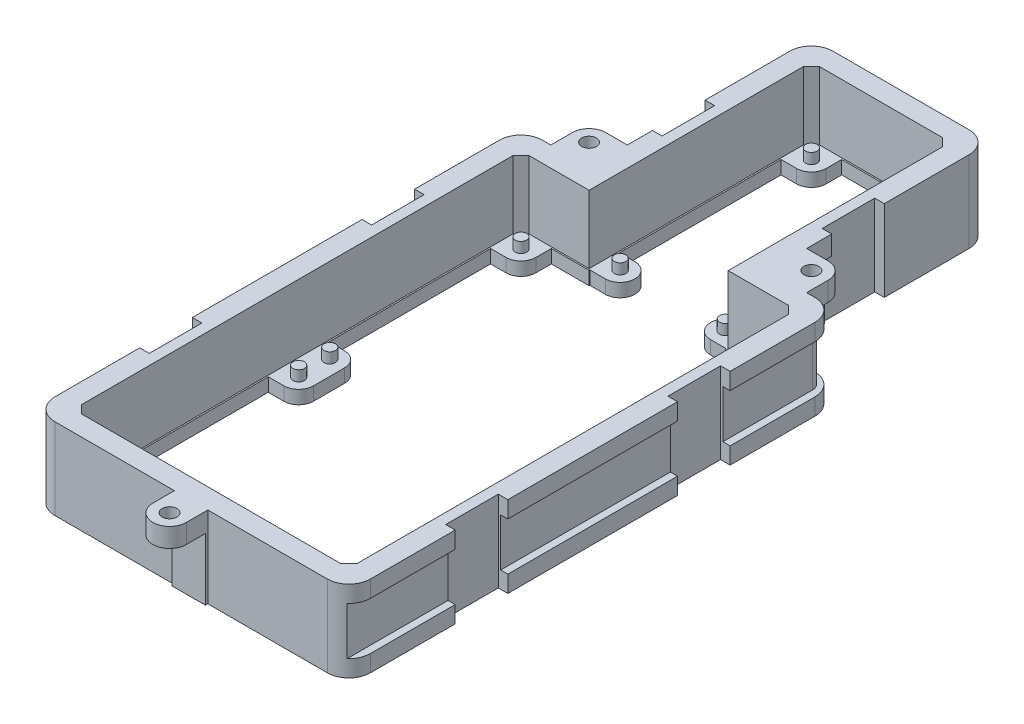
from build123d import *

# Parameters (mm, degrees)
EXTRUDE_THIN1_DEPTH          = 17
CHAMFER1_SIZE                = 1.5
SKETCH2_R                    = 1.2
BOSS_EXTRUDE1_DEPTH          = 5
BOSS_EXTRUDE1_2_DEPTH        = 5
BOSS_EXTRUDE1_3_DEPTH        = 5
BOSS_EXTRUDE1_4_DEPTH        = 5
BOSS_EXTRUDE1_5_DEPTH        = 5
BOSS_EXTRUDE1_6_DEPTH        = 5
BOSS_EXTRUDE1_7_DEPTH        = 5
BOSS_EXTRUDE1_8_DEPTH        = 5
BOSS_EXTRUDE1_9_DEPTH        = 5
BOSS_EXTRUDE1_10_DEPTH       = 5
BOSS_EXTRUDE1_11_DEPTH       = 5
BOSS_EXTRUDE1_12_DEPTH       = 5
BOSS_EXTRUDE1_13_DEPTH       = 5
BOSS_EXTRUDE1_14_DEPTH       = 5
BOSS_EXTRUDE3_DEPTH          = 2.8
SKETCH4_R                    = 1.55
BOSS_EXTRUDE4_DEPTH          = 4
SKETCH5_R                    = 1.55
BOSS_EXTRUDE5_DEPTH          = 4
FILLET1_R                    = 5
SKETCH6_W                    = 4
SKETCH6_H                    = 10
CUT_EXTRUDE1_DEPTH           = 105.953561159
CUT_EXTRUDE_THIN1_DEPTH      = 120.924976548
CUT_EXTRUDE_THIN1_DEPTH_BACK = 2
SKETCH7_W                    = 103
SKETCH7_H                    = 10
CUT_EXTRUDE_THIN2_DEPTH      = 120.924976548
CUT_EXTRUDE_THIN2_DEPTH_BACK = 2
SKETCH8_W                    = 103
SKETCH8_H                    = 10
SKETCH9_W                    = 13.25
SKETCH9_H                    = 13
CUT_EXTRUDE2_DEPTH           = 2
CUT_EXTRUDE3_DEPTH           = 14.25
FILLET2_R                    = 2
SKETCH11_W                   = 13.25
SKETCH11_H                   = 13
CUT_EXTRUDE4_DEPTH           = 2
SKETCH12_W                   = 2
SKETCH12_H                   = 9.5
CUT_EXTRUDE5_DEPTH           = 14.25
FILLET3_R                    = 2
CUT_EXTRUDE_THIN4_START      = -20
CUT_EXTRUDE_THIN4_DEPTH      = 20
CUT_EXTRUDE_THIN5_DEPTH      = 10
CUT_EXTRUDE_THIN6_DEPTH      = 14.2


with BuildPart() as part:
    # Sketch1 → Extrude-Thin1 (new body)
    with BuildSketch(Plane(origin=(0, 0, 0), x_dir=(1, 0, 0), z_dir=(0, 1, 0))):
        Polygon((19.25, 51.5), (33.5, 51.5), (33.5, -51.5), (-33.5, -51.5), (-33.5, 51.5), (-19.25, 51.5), (-19.25, 98), (19.25, 98), align=None)
        Polygon((14.25, 46.5), (28.5, 46.5), (28.5, -46.5), (-28.5, -46.5), (-28.5, 46.5), (-14.25, 46.5), (-14.25, 93), (14.25, 93), align=None, mode=Mode.SUBTRACT)
    extrude(amount=EXTRUDE_THIN1_DEPTH)

    # Chamfer1
    chamfer1_edges = [part.edges().sort_by_distance(p)[0] for p in [
        (28.5, 8.5, 46.5),
        (28.5, 8.5, -46.5),
        (14.25, 8.5, -93),
        (-14.25, 8.5, -93),
        (-28.5, 8.5, -46.5),
        (-28.5, 8.5, 46.5),
    ]]
    chamfer(chamfer1_edges, length=CHAMFER1_SIZE)



with BuildPart() as body_2:
    # Sketch2 → Boss-Extrude1 (new body)
    with BuildSketch(Plane(origin=(0, 0, 0), x_dir=(1, 0, 0), z_dir=(0, 1, 0))):
        with Locations(Location((11, 89.75, 0), (0, 0, 270))):
            Circle(SKETCH2_R)
    extrude(amount=BOSS_EXTRUDE1_DEPTH)


with BuildPart() as body_3:
    # Sketch2 → Boss-Extrude1 2 (new body)
    with BuildSketch(Plane(origin=(0, 0, 0), x_dir=(1, 0, 0), z_dir=(0, 1, 0))):
        with Locations(Location((-11, 89.75, 0), (0, 0, 270))):
            Circle(SKETCH2_R)
    extrude(amount=BOSS_EXTRUDE1_2_DEPTH)


with BuildPart() as body_4:
    # Sketch2 → Boss-Extrude1 3 (new body)
    with BuildSketch(Plane(origin=(0, 0, 0), x_dir=(1, 0, 0), z_dir=(0, 1, 0))):
        with Locations(Location((11, 49.75, 0), (0, 0, 270))):
            Circle(SKETCH2_R)
    extrude(amount=BOSS_EXTRUDE1_3_DEPTH)


with BuildPart() as body_5:
    # Sketch2 → Boss-Extrude1 4 (new body)
    with BuildSketch(Plane(origin=(0, 0, 0), x_dir=(1, 0, 0), z_dir=(0, 1, 0))):
        with Locations(Location((-11, 49.75, 0), (0, 0, 270))):
            Circle(SKETCH2_R)
    extrude(amount=BOSS_EXTRUDE1_4_DEPTH)


with BuildPart() as body_6:
    # Sketch2 → Boss-Extrude1 5 (new body)
    with BuildSketch(Plane(origin=(0, 0, 0), x_dir=(1, 0, 0), z_dir=(0, 1, 0))):
        with Locations(Location((25.25, -43.25, 0), (0, 0, 270))):
            Circle(SKETCH2_R)
    extrude(amount=BOSS_EXTRUDE1_5_DEPTH)


with BuildPart() as body_7:
    # Sketch2 → Boss-Extrude1 6 (new body)
    with BuildSketch(Plane(origin=(0, 0, 0), x_dir=(1, 0, 0), z_dir=(0, 1, 0))):
        with Locations(Location((25.25, 43.25, 0), (0, 0, 270))):
            Circle(SKETCH2_R)
    extrude(amount=BOSS_EXTRUDE1_6_DEPTH)


with BuildPart() as body_8:
    # Sketch2 → Boss-Extrude1 7 (new body)
    with BuildSketch(Plane(origin=(0, 0, 0), x_dir=(1, 0, 0), z_dir=(0, 1, 0))):
        with Locations(Location((25.25, 3.25, 0), (0, 0, 270))):
            Circle(SKETCH2_R)
    extrude(amount=BOSS_EXTRUDE1_7_DEPTH)


with BuildPart() as body_9:
    # Sketch2 → Boss-Extrude1 8 (new body)
    with BuildSketch(Plane(origin=(0, 0, 0), x_dir=(1, 0, 0), z_dir=(0, 1, 0))):
        with Locations(Location((25.25, -3.25, 0), (0, 0, 270))):
            Circle(SKETCH2_R)
    extrude(amount=BOSS_EXTRUDE1_8_DEPTH)


with BuildPart() as body_10:
    # Sketch2 → Boss-Extrude1 9 (new body)
    with BuildSketch(Plane(origin=(0, 0, 0), x_dir=(1, 0, 0), z_dir=(0, 1, 0))):
        with Locations(Location((-25.25, -43.25, 0), (0, 0, 270))):
            Circle(SKETCH2_R)
    extrude(amount=BOSS_EXTRUDE1_9_DEPTH)


with BuildPart() as body_11:
    # Sketch2 → Boss-Extrude1 10 (new body)
    with BuildSketch(Plane(origin=(0, 0, 0), x_dir=(1, 0, 0), z_dir=(0, 1, 0))):
        with Locations(Location((-25.25, -3.25, 0), (0, 0, 270))):
            Circle(SKETCH2_R)
    extrude(amount=BOSS_EXTRUDE1_10_DEPTH)


with BuildPart() as body_12:
    # Sketch2 → Boss-Extrude1 11 (new body)
    with BuildSketch(Plane(origin=(0, 0, 0), x_dir=(1, 0, 0), z_dir=(0, 1, 0))):
        with Locations(Location((-25.25, 3.25, 0), (0, 0, 270))):
            Circle(SKETCH2_R)
    extrude(amount=BOSS_EXTRUDE1_11_DEPTH)


with BuildPart() as body_13:
    # Sketch2 → Boss-Extrude1 12 (new body)
    with BuildSketch(Plane(origin=(0, 0, 0), x_dir=(1, 0, 0), z_dir=(0, 1, 0))):
        with Locations(Location((-25.25, 43.25, 0), (0, 0, 270))):
            Circle(SKETCH2_R)
    extrude(amount=BOSS_EXTRUDE1_12_DEPTH)


with BuildPart() as body_14:
    # Sketch2 → Boss-Extrude1 13 (new body)
    with BuildSketch(Plane(origin=(0, 0, 0), x_dir=(1, 0, 0), z_dir=(0, 1, 0))):
        with Locations(Location((3.25, -43.25, 0), (0, 0, 270))):
            Circle(SKETCH2_R)
    extrude(amount=BOSS_EXTRUDE1_13_DEPTH)


with BuildPart() as body_15:
    # Sketch2 → Boss-Extrude1 14 (new body)
    with BuildSketch(Plane(origin=(0, 0, 0), x_dir=(1, 0, 0), z_dir=(0, 1, 0))):
        with Locations(Location((-3.25, -43.25, 0), (0, 0, 270))):
            Circle(SKETCH2_R)
    extrude(amount=BOSS_EXTRUDE1_14_DEPTH)


with BuildPart() as part_1:
    add(part.part)

    add(body_2.part)  # Boss-Extrude3 merges body 2

    add(body_3.part)  # Boss-Extrude3 merges body 3

    add(body_4.part)  # Boss-Extrude3 merges body 4

    add(body_5.part)  # Boss-Extrude3 merges body 5

    add(body_6.part)  # Boss-Extrude3 merges body 6

    add(body_7.part)  # Boss-Extrude3 merges body 7

    add(body_8.part)  # Boss-Extrude3 merges body 8

    add(body_9.part)  # Boss-Extrude3 merges body 9

    add(body_10.part)  # Boss-Extrude3 merges body 10

    add(body_11.part)  # Boss-Extrude3 merges body 11

    add(body_12.part)  # Boss-Extrude3 merges body 12

    add(body_13.part)  # Boss-Extrude3 merges body 13

    add(body_14.part)  # Boss-Extrude3 merges body 14

    add(body_15.part)  # Boss-Extrude3 merges body 15
    # Sketch3 → Boss-Extrude3 (add)
    with BuildSketch(Plane(origin=(0, 0, 0), x_dir=(-1, 0, 0), z_dir=(0, -1, 0))):
        Polygon((33.5, -51.5), (-33.5, -51.5), (-33.5, 51.5), (-19.25, 51.5), (-19.25, 98), (19.25, 98), (19.25, 51.5), (33.5, 51.5), align=None)
        with BuildLine():
            Line((14.25, 53), (14.25, 86.5))
            Line((14.25, 86.5), (11, 86.5))
            ThreePointArc((11, 86.5), (8.701902961, 87.451902961), (7.75, 89.75))
            Line((7.75, 89.75), (7.75, 93))
            Line((7.75, 93), (-7.75, 93))
            Line((-7.75, 93), (-7.75, 89.75))
            ThreePointArc((-7.75, 89.75), (-8.701902961, 87.451902961), (-11, 86.5))
            Line((-11, 86.5), (-14.25, 86.5))
            Line((-14.25, 86.5), (-14.25, 53))
            Line((-14.25, 53), (-11, 53))
            ThreePointArc((-11, 53), (-7.75, 49.75), (-11, 46.5))
            Line((-11, 46.5), (-14.25, 46.5))
            Line((-14.25, 46.5), (-22, 46.5))
            Line((-22, 46.5), (-22, 43.25))
            ThreePointArc((-22, 43.25), (-22.951902961, 40.951902961), (-25.25, 40))
            Line((-25.25, 40), (-28.5, 40))
            Line((-28.5, 40), (-28.5, 6.5))
            Line((-28.5, 6.5), (-25.25, 6.5))
            ThreePointArc((-25.25, 6.5), (-22.951902961, 5.548097039), (-22, 3.25))
            Line((-22, 3.25), (-22, -3.25))
            ThreePointArc((-22, -3.25), (-22.951902961, -5.548097039), (-25.25, -6.5))
            Line((-25.25, -6.5), (-28.5, -6.5))
            Line((-28.5, -6.5), (-28.5, -40))
            Line((-28.5, -40), (-25.25, -40))
            ThreePointArc((-25.25, -40), (-22.951902961, -40.951902961), (-22, -43.25))
            Line((-22, -43.25), (-22, -46.5))
            Line((-22, -46.5), (-6.5, -46.5))
            Line((-6.5, -46.5), (-6.5, -43.25))
            ThreePointArc((-6.5, -43.25), (-5.548097039, -40.951902961), (-3.25, -40))
            Line((-3.25, -40), (3.25, -40))
            ThreePointArc((3.25, -40), (5.548097039, -40.951902961), (6.5, -43.25))
            Line((6.5, -43.25), (6.5, -46.5))
            Line((6.5, -46.5), (22, -46.5))
            Line((22, -46.5), (22, -43.25))
            ThreePointArc((22, -43.25), (22.951902961, -40.951902961), (25.25, -40))
            Line((25.25, -40), (28.5, -40))
            Line((28.5, -40), (28.5, -6.5))
            Line((28.5, -6.5), (25.25, -6.5))
            ThreePointArc((25.25, -6.5), (22.951902961, -5.548097039), (22, -3.25))
            Line((22, -3.25), (22, 3.25))
            ThreePointArc((22, 3.25), (22.951902961, 5.548097039), (25.25, 6.5))
            Line((25.25, 6.5), (28.5, 6.5))
            Line((28.5, 6.5), (28.5, 40))
            Line((28.5, 40), (25.25, 40))
            ThreePointArc((25.25, 40), (22.951902961, 40.951902961), (22, 43.25))
            Line((22, 43.25), (22, 46.5))
            Line((22, 46.5), (14.25, 46.5))
            Line((14.25, 46.5), (11, 46.5))
            ThreePointArc((11, 46.5), (7.75, 49.75), (11, 53))
            Line((11, 53), (14.25, 53))
        make_face(mode=Mode.SUBTRACT)
    extrude(amount=-BOSS_EXTRUDE3_DEPTH)

    # Sketch4 → Boss-Extrude4 (add)
    # profile 1 of 2: a face of its own
    with BuildSketch(Plane(origin=(0, 17, 0), x_dir=(1, 0, 0), z_dir=(0, 1, 0))):
        with BuildLine():
            Line((-27.25, 55.5), (-27.25, 51.5))
            Line((-27.25, 51.5), (-19.25, 51.5))
            Line((-19.25, 51.5), (-19.25, 59.5))
            Line((-19.25, 59.5), (-23.25, 59.5))
            ThreePointArc((-23.25, 59.5), (-26.078427125, 58.328427125), (-27.25, 55.5))
        make_face()
        with Locations(Location((-23.25, 55.5, 0), (0, 0, 270))):
            Circle(SKETCH4_R, mode=Mode.SUBTRACT)
    # profile 2 of 2: a face of its own
    with BuildSketch(Plane(origin=(0, 17, 0), x_dir=(1, 0, 0), z_dir=(0, 1, 0))):
        with BuildLine():
            Line((23.25, 59.5), (19.25, 59.5))
            Line((19.25, 59.5), (19.25, 51.5))
            Line((19.25, 51.5), (27.25, 51.5))
            Line((27.25, 51.5), (27.25, 55.5))
            ThreePointArc((27.25, 55.5), (26.078427125, 58.328427125), (23.25, 59.5))
        make_face()
        with Locations(Location((23.25, 55.5, 0), (0, 0, 270))):
            Circle(SKETCH4_R, mode=Mode.SUBTRACT)
    extrude(amount=-BOSS_EXTRUDE4_DEPTH)

    # Sketch5 → Boss-Extrude5 (add)
    with BuildSketch(Plane(origin=(0, 17, 0), x_dir=(1, 0, 0), z_dir=(0, 1, 0))):
        with BuildLine():
            Line((-4, -55.5), (-4, -51.5))
            Line((-4, -51.5), (4, -51.5))
            Line((4, -51.5), (4, -55.5))
            ThreePointArc((4, -55.5), (0, -59.5), (-4, -55.5))
        make_face()
        with Locations(Location((0, -55.5, 0), (0, 0, 270))):
            Circle(SKETCH5_R, mode=Mode.SUBTRACT)
    extrude(amount=-BOSS_EXTRUDE5_DEPTH)

    # Fillet1
    fillet1_edges = [part_1.edges().sort_by_distance(p)[0] for p in [
        (33.5, 8.5, 51.5),
        (-33.5, 8.5, 51.5),
        (-33.5, 8.5, -51.5),
        (-19.25, 8.5, -98),
        (19.25, 8.5, -98),
        (33.5, 8.5, -51.5),
    ]]
    fillet(fillet1_edges, radius=FILLET1_R)

    # Sketch6 → Cut-Extrude1 (cut, through all)
    with BuildSketch(Plane(origin=(0, 17, 0), x_dir=(1, 0, 0), z_dir=(0, 1, 0))):
        with Locations((33.5, -23.25)):
            Rectangle(SKETCH6_W, SKETCH6_H)
        with Locations((33.5, 23.25)):
            Rectangle(SKETCH6_W, SKETCH6_H)
        with Locations((-33.5, 23.25)):
            Rectangle(SKETCH6_W, SKETCH6_H)
        with Locations((-33.5, -23.25)):
            Rectangle(SKETCH6_W, SKETCH6_H)
        with Locations((-19.25, 69.75)):
            Rectangle(SKETCH6_W, SKETCH6_H)
        with Locations((19.25, 69.75)):
            Rectangle(SKETCH6_W, SKETCH6_H)
    extrude(amount=-CUT_EXTRUDE1_DEPTH, mode=Mode.SUBTRACT)

    # Sketch7 → Cut-Extrude-Thin1 (cut, two sides: drawn at the far end of the back side and taken through both)
    with BuildSketch(Plane.ZY.offset(33.5).offset(-CUT_EXTRUDE_THIN1_DEPTH_BACK)):
        with Locations((0, 8.5)):
            Rectangle(SKETCH7_W, SKETCH7_H)
    extrude(amount=CUT_EXTRUDE_THIN1_DEPTH + CUT_EXTRUDE_THIN1_DEPTH_BACK, mode=Mode.SUBTRACT)

    # Sketch8 → Cut-Extrude-Thin2 (cut, two sides: drawn at the far end of the back side and taken through both)
    with BuildSketch(Plane(origin=(33.5, 0, 0), x_dir=(0, 0, -1), z_dir=(1, 0, 0)).offset(-CUT_EXTRUDE_THIN2_DEPTH_BACK)):
        with Locations((0, 8.5)):
            Rectangle(SKETCH8_W, SKETCH8_H)
    extrude(amount=CUT_EXTRUDE_THIN2_DEPTH + CUT_EXTRUDE_THIN2_DEPTH_BACK, mode=Mode.SUBTRACT)

    # Sketch9 → Cut-Extrude2 (cut)
    with BuildSketch(Plane(origin=(19.25, 0, 0), x_dir=(0, 0, -1), z_dir=(1, 0, 0))):
        with Locations((58.125, 6.5)):
            Rectangle(SKETCH9_W, SKETCH9_H)
    extrude(amount=-CUT_EXTRUDE2_DEPTH, mode=Mode.SUBTRACT)

    # Sketch10 → Cut-Extrude3 (cut)
    with BuildSketch(Plane(origin=(31.5, 0, 0), x_dir=(0, 0, -1), z_dir=(1, 0, 0))):
        Polygon((50.5, 3.5), (51.5, 3.5), (51.5, 13), (49.5, 13), (49.5, 3.5), align=None)
    extrude(amount=-CUT_EXTRUDE3_DEPTH, mode=Mode.SUBTRACT)

    # Fillet2
    fillet2_edges = [part_1.edges().sort_by_distance(p)[0] for p in [
        (31.5, 8.25, -49.5),
    ]]
    fillet(fillet2_edges, radius=FILLET2_R)

    # Sketch11 → Cut-Extrude4 (cut)
    with BuildSketch(Plane.ZY.offset(19.25)):
        with Locations((-58.125, 6.5)):
            Rectangle(SKETCH11_W, SKETCH11_H)
    extrude(amount=-CUT_EXTRUDE4_DEPTH, mode=Mode.SUBTRACT)

    # Sketch12 → Cut-Extrude5 (cut)
    with BuildSketch(Plane.ZY.offset(31.5)):
        with Locations((-50.5, 8.25)):
            Rectangle(SKETCH12_W, SKETCH12_H)
    extrude(amount=-CUT_EXTRUDE5_DEPTH, mode=Mode.SUBTRACT)

    # Fillet3
    fillet3_edges = [part_1.edges().sort_by_distance(p)[0] for p in [
        (-31.5, 8.25, -49.5),
    ]]
    fillet(fillet3_edges, radius=FILLET3_R)

    # Sketch13 → Cut-Extrude-Thin4 (cut)
    with BuildSketch(Plane(origin=(0, 17, 0), x_dir=(1, 0, 0), z_dir=(0, 1, 0)).offset(CUT_EXTRUDE_THIN4_START)):
        with BuildLine():
            Line((-19.25, 93), (-19.25, 74.75))
            Line((-19.25, 74.75), (-17.25, 74.75))
            Line((-17.25, 74.75), (-17.25, 64.75))
            Line((-17.25, 64.75), (-19.25, 64.75))
            Line((-19.25, 64.75), (-19.25, 59.5))
            Line((-19.25, 59.5), (-23.25, 59.5))
            ThreePointArc((-23.25, 59.5), (-26.078427125, 58.328427125), (-27.25, 55.5))
            Line((-27.25, 55.5), (-27.25, 51.5))
            Line((-27.25, 51.5), (-28.5, 51.5))
            ThreePointArc((-28.5, 51.5), (-32.035533906, 50.035533906), (-33.5, 46.5))
            Line((-33.5, 46.5), (-33.5, 28.25))
            Line((-33.5, 28.25), (-31.5, 28.25))
            Line((-31.5, 28.25), (-31.5, 18.25))
            Line((-31.5, 18.25), (-33.5, 18.25))
            Line((-33.5, 18.25), (-33.5, -18.25))
            Line((-33.5, -18.25), (-31.5, -18.25))
            Line((-31.5, -18.25), (-31.5, -28.25))
            Line((-31.5, -28.25), (-33.5, -28.25))
            Line((-33.5, -28.25), (-33.5, -46.5))
            ThreePointArc((-33.5, -46.5), (-32.035533906, -50.035533906), (-28.5, -51.5))
            Line((-28.5, -51.5), (-4, -51.5))
            Line((-4, -51.5), (-4, -55.5))
            ThreePointArc((-4, -55.5), (0, -59.5), (4, -55.5))
            Line((4, -55.5), (4, -51.5))
            Line((4, -51.5), (28.5, -51.5))
            ThreePointArc((28.5, -51.5), (32.035533906, -50.035533906), (33.5, -46.5))
            Line((33.5, -46.5), (33.5, -28.25))
            Line((33.5, -28.25), (31.5, -28.25))
            Line((31.5, -28.25), (31.5, -18.25))
            Line((31.5, -18.25), (33.5, -18.25))
            Line((33.5, -18.25), (33.5, 18.25))
            Line((33.5, 18.25), (31.5, 18.25))
            Line((31.5, 18.25), (31.5, 28.25))
            Line((31.5, 28.25), (33.5, 28.25))
            Line((33.5, 28.25), (33.5, 46.5))
            ThreePointArc((33.5, 46.5), (32.035533906, 50.035533906), (28.5, 51.5))
            Line((28.5, 51.5), (27.25, 51.5))
            Line((27.25, 51.5), (27.25, 55.5))
            ThreePointArc((27.25, 55.5), (26.078427125, 58.328427125), (23.25, 59.5))
            Line((23.25, 59.5), (19.25, 59.5))
            Line((19.25, 59.5), (19.25, 64.75))
            Line((19.25, 64.75), (17.25, 64.75))
            Line((17.25, 64.75), (17.25, 74.75))
            Line((17.25, 74.75), (19.25, 74.75))
            Line((19.25, 74.75), (19.25, 93))
            ThreePointArc((19.25, 93), (17.785533906, 96.535533906), (14.25, 98))
            Line((14.25, 98), (-14.25, 98))
            ThreePointArc((-14.25, 98), (-17.785533906, 96.535533906), (-19.25, 93))
        make_face()
        with BuildLine():
            Line((-18.75, 93), (-18.75, 75.25))
            Line((-18.75, 75.25), (-16.75, 75.25))
            Line((-16.75, 75.25), (-16.75, 64.25))
            Line((-16.75, 64.25), (-18.75, 64.25))
            Line((-18.75, 64.25), (-18.75, 59))
            Line((-18.75, 59), (-23.25, 59))
            ThreePointArc((-23.25, 59), (-25.724873734, 57.974873734), (-26.75, 55.5))
            Line((-26.75, 55.5), (-26.75, 51))
            Line((-26.75, 51), (-28.5, 51))
            ThreePointArc((-28.5, 51), (-31.681980515, 49.681980515), (-33, 46.5))
            Line((-33, 46.5), (-33, 28.75))
            Line((-33, 28.75), (-31, 28.75))
            Line((-31, 28.75), (-31, 17.75))
            Line((-31, 17.75), (-33, 17.75))
            Line((-33, 17.75), (-33, -17.75))
            Line((-33, -17.75), (-31, -17.75))
            Line((-31, -17.75), (-31, -28.75))
            Line((-31, -28.75), (-33, -28.75))
            Line((-33, -28.75), (-33, -46.5))
            ThreePointArc((-33, -46.5), (-31.681980515, -49.681980515), (-28.5, -51))
            Line((-28.5, -51), (-3.5, -51))
            Line((-3.5, -51), (-3.5, -55.5))
            ThreePointArc((-3.5, -55.5), (0, -59), (3.5, -55.5))
            Line((3.5, -55.5), (3.5, -51))
            Line((3.5, -51), (28.5, -51))
            ThreePointArc((28.5, -51), (31.681980515, -49.681980515), (33, -46.5))
            Line((33, -46.5), (33, -28.75))
            Line((33, -28.75), (31, -28.75))
            Line((31, -28.75), (31, -17.75))
            Line((31, -17.75), (33, -17.75))
            Line((33, -17.75), (33, 17.75))
            Line((33, 17.75), (31, 17.75))
            Line((31, 17.75), (31, 28.75))
            Line((31, 28.75), (33, 28.75))
            Line((33, 28.75), (33, 46.5))
            ThreePointArc((33, 46.5), (31.681980515, 49.681980515), (28.5, 51))
            Line((28.5, 51), (26.75, 51))
            Line((26.75, 51), (26.75, 55.5))
            ThreePointArc((26.75, 55.5), (25.724873734, 57.974873734), (23.25, 59))
            Line((23.25, 59), (18.75, 59))
            Line((18.75, 59), (18.75, 64.25))
            Line((18.75, 64.25), (16.75, 64.25))
            Line((16.75, 64.25), (16.75, 75.25))
            Line((16.75, 75.25), (18.75, 75.25))
            Line((18.75, 75.25), (18.75, 93))
            ThreePointArc((18.75, 93), (17.431980515, 96.181980515), (14.25, 97.5))
            Line((14.25, 97.5), (-14.25, 97.5))
            ThreePointArc((-14.25, 97.5), (-17.431980515, 96.181980515), (-18.75, 93))
        make_face(mode=Mode.SUBTRACT)
    extrude(amount=CUT_EXTRUDE_THIN4_DEPTH, mode=Mode.SUBTRACT)

    # Sketch14 → Cut-Extrude-Thin5 (cut)
    with BuildSketch(Plane(origin=(0, 2.8, 0), x_dir=(1, 0, 0), z_dir=(0, 1, 0))):
        with BuildLine():
            Line((7.6, 93), (7.6, 89.75))
            ThreePointArc((7.6, 89.75), (8.595836944, 87.345836944), (11, 86.35))
            Line((11, 86.35), (14.25, 86.35))
            Line((14.25, 86.35), (14.25, 86.65))
            Line((14.25, 86.65), (11, 86.65))
            ThreePointArc((11, 86.65), (8.807968978, 87.557968978), (7.9, 89.75))
            Line((7.9, 89.75), (7.9, 93))
            Line((7.9, 93), (7.6, 93))
        make_face()
        with BuildLine():
            Line((-7.9, 93), (-7.9, 89.75))
            ThreePointArc((-7.9, 89.75), (-8.807968978, 87.557968978), (-11, 86.65))
            Line((-11, 86.65), (-14.25, 86.65))
            Line((-14.25, 86.65), (-14.25, 86.35))
            Line((-14.25, 86.35), (-11, 86.35))
            ThreePointArc((-11, 86.35), (-8.595836944, 87.345836944), (-7.6, 89.75))
            Line((-7.6, 89.75), (-7.6, 93))
            Line((-7.6, 93), (-7.9, 93))
        make_face()
        with BuildLine():
            Line((-14.25, 52.85), (-11, 52.85))
            ThreePointArc((-11, 52.85), (-7.9, 49.75), (-11, 46.65))
            Line((-11, 46.65), (-14.25, 46.65))
            Line((-14.25, 46.65), (-14.25, 46.35))
            Line((-14.25, 46.35), (-11, 46.35))
            ThreePointArc((-11, 46.35), (-7.6, 49.75), (-11, 53.15))
            Line((-11, 53.15), (-14.25, 53.15))
            Line((-14.25, 53.15), (-14.25, 52.85))
        make_face()
        with BuildLine():
            Line((14.25, 53.15), (11, 53.15))
            ThreePointArc((11, 53.15), (7.6, 49.75), (11, 46.35))
            Line((11, 46.35), (14.25, 46.35))
            Line((14.25, 46.35), (14.25, 46.65))
            Line((14.25, 46.65), (11, 46.65))
            ThreePointArc((11, 46.65), (7.9, 49.75), (11, 52.85))
            Line((11, 52.85), (14.25, 52.85))
            Line((14.25, 52.85), (14.25, 53.15))
        make_face()
        with BuildLine():
            Line((21.85, 46.5), (21.85, 43.25))
            ThreePointArc((21.85, 43.25), (22.845836944, 40.845836944), (25.25, 39.85))
            Line((25.25, 39.85), (28.5, 39.85))
            Line((28.5, 39.85), (28.5, 40.15))
            Line((28.5, 40.15), (25.25, 40.15))
            ThreePointArc((25.25, 40.15), (23.057968978, 41.057968978), (22.15, 43.25))
            Line((22.15, 43.25), (22.15, 46.5))
            Line((22.15, 46.5), (21.85, 46.5))
        make_face()
        with BuildLine():
            Line((28.5, 6.65), (25.25, 6.65))
            ThreePointArc((25.25, 6.65), (22.845836944, 5.654163056), (21.85, 3.25))
            Line((21.85, 3.25), (21.85, -3.25))
            ThreePointArc((21.85, -3.25), (22.845836944, -5.654163056), (25.25, -6.65))
            Line((25.25, -6.65), (28.5, -6.65))
            Line((28.5, -6.65), (28.5, -6.35))
            Line((28.5, -6.35), (25.25, -6.35))
            ThreePointArc((25.25, -6.35), (23.057968978, -5.442031022), (22.15, -3.25))
            Line((22.15, -3.25), (22.15, 3.25))
            ThreePointArc((22.15, 3.25), (23.057968978, 5.442031022), (25.25, 6.35))
            Line((25.25, 6.35), (28.5, 6.35))
            Line((28.5, 6.35), (28.5, 6.65))
        make_face()
        with BuildLine():
            Line((28.5, -39.85), (25.25, -39.85))
            ThreePointArc((25.25, -39.85), (22.845836944, -40.845836944), (21.85, -43.25))
            Line((21.85, -43.25), (21.85, -46.5))
            Line((21.85, -46.5), (22.15, -46.5))
            Line((22.15, -46.5), (22.15, -43.25))
            ThreePointArc((22.15, -43.25), (23.057968978, -41.057968978), (25.25, -40.15))
            Line((25.25, -40.15), (28.5, -40.15))
            Line((28.5, -40.15), (28.5, -39.85))
        make_face()
        with BuildLine():
            Line((6.65, -46.5), (6.65, -43.25))
            ThreePointArc((6.65, -43.25), (5.654163056, -40.845836944), (3.25, -39.85))
            Line((3.25, -39.85), (-3.25, -39.85))
            ThreePointArc((-3.25, -39.85), (-5.654163056, -40.845836944), (-6.65, -43.25))
            Line((-6.65, -43.25), (-6.65, -46.5))
            Line((-6.65, -46.5), (-6.35, -46.5))
            Line((-6.35, -46.5), (-6.35, -43.25))
            ThreePointArc((-6.35, -43.25), (-5.442031022, -41.057968978), (-3.25, -40.15))
            Line((-3.25, -40.15), (3.25, -40.15))
            ThreePointArc((3.25, -40.15), (5.442031022, -41.057968978), (6.35, -43.25))
            Line((6.35, -43.25), (6.35, -46.5))
            Line((6.35, -46.5), (6.65, -46.5))
        make_face()
        with BuildLine():
            Line((-21.85, -46.5), (-21.85, -43.25))
            ThreePointArc((-21.85, -43.25), (-22.845836944, -40.845836944), (-25.25, -39.85))
            Line((-25.25, -39.85), (-28.5, -39.85))
            Line((-28.5, -39.85), (-28.5, -40.15))
            Line((-28.5, -40.15), (-25.25, -40.15))
            ThreePointArc((-25.25, -40.15), (-23.057968978, -41.057968978), (-22.15, -43.25))
            Line((-22.15, -43.25), (-22.15, -46.5))
            Line((-22.15, -46.5), (-21.85, -46.5))
        make_face()
        with BuildLine():
            Line((-28.5, -6.65), (-25.25, -6.65))
            ThreePointArc((-25.25, -6.65), (-22.845836944, -5.654163056), (-21.85, -3.25))
            Line((-21.85, -3.25), (-21.85, 3.25))
            ThreePointArc((-21.85, 3.25), (-22.845836944, 5.654163056), (-25.25, 6.65))
            Line((-25.25, 6.65), (-28.5, 6.65))
            Line((-28.5, 6.65), (-28.5, 6.35))
            Line((-28.5, 6.35), (-25.25, 6.35))
            ThreePointArc((-25.25, 6.35), (-23.057968978, 5.442031022), (-22.15, 3.25))
            Line((-22.15, 3.25), (-22.15, -3.25))
            ThreePointArc((-22.15, -3.25), (-23.057968978, -5.442031022), (-25.25, -6.35))
            Line((-25.25, -6.35), (-28.5, -6.35))
            Line((-28.5, -6.35), (-28.5, -6.65))
        make_face()
        with BuildLine():
            Line((-28.5, 39.85), (-25.25, 39.85))
            ThreePointArc((-25.25, 39.85), (-22.845836944, 40.845836944), (-21.85, 43.25))
            Line((-21.85, 43.25), (-21.85, 46.5))
            Line((-21.85, 46.5), (-22.15, 46.5))
            Line((-22.15, 46.5), (-22.15, 43.25))
            ThreePointArc((-22.15, 43.25), (-23.057968978, 41.057968978), (-25.25, 40.15))
            Line((-25.25, 40.15), (-28.5, 40.15))
            Line((-28.5, 40.15), (-28.5, 39.85))
        make_face()
    extrude(amount=-CUT_EXTRUDE_THIN5_DEPTH, mode=Mode.SUBTRACT)

    # Sketch15 → Cut-Extrude-Thin6 (cut)
    with BuildSketch(Plane(origin=(0, 17, 0), x_dir=(1, 0, 0), z_dir=(0, 1, 0))):
        Polygon((14.55, 46.8), (14.55, 91.624264069), (12.874264069, 93.3), (-12.874264069, 93.3), (-14.55, 91.624264069), (-14.55, 46.8), (-27.124264069, 46.8), (-28.8, 45.124264069), (-28.8, -45.124264069), (-27.124264069, -46.8), (27.124264069, -46.8), (28.8, -45.124264069), (28.8, 45.124264069), (27.124264069, 46.8), align=None)
        Polygon((14.25, 46.5), (14.25, 91.5), (12.75, 93), (-12.75, 93), (-14.25, 91.5), (-14.25, 46.5), (-27, 46.5), (-28.5, 45), (-28.5, -45), (-27, -46.5), (27, -46.5), (28.5, -45), (28.5, 45), (27, 46.5), align=None, mode=Mode.SUBTRACT)
    extrude(amount=-CUT_EXTRUDE_THIN6_DEPTH, mode=Mode.SUBTRACT)


solid = part_1.part
